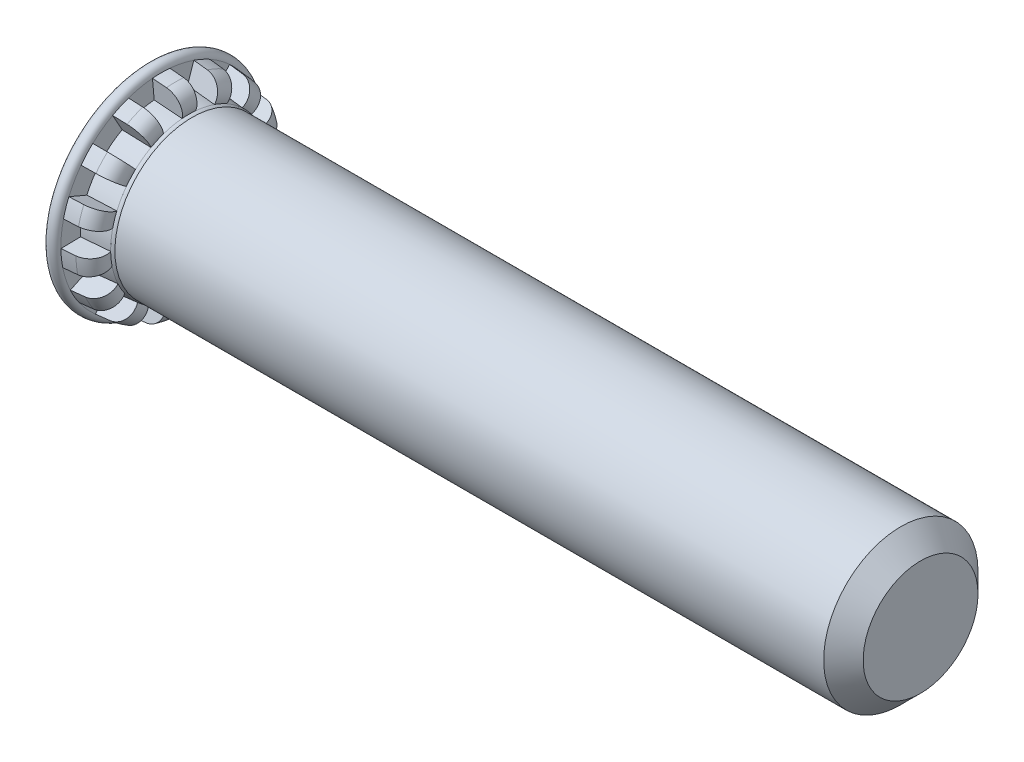
from build123d import *

# Parameters (mm, degrees)
BOSS_EXTRUDE1_START = 12.5
SKETCH2_R           = 2.5
BOSS_EXTRUDE1_DEPTH = 25
REVOLVE2_ANGLE      = 10
CIRPATTERN1_COUNT   = 15
CHAMFER1_SIZE       = 0.64


with BuildPart() as part:
    # Sketch2 → Boss-Extrude1 (new body)
    with BuildSketch(Plane(origin=(0, 0, 0), x_dir=(0, 0, -1), z_dir=(1, 0, 0)).offset(BOSS_EXTRUDE1_START)):
        Circle(SKETCH2_R)
    extrude(amount=-BOSS_EXTRUDE1_DEPTH)

    # Sketch5 → Revolve1 (revolve)
    with BuildSketch(Plane.XY, mode=Mode.PRIVATE) as revolve1_sk:
        with BuildLine():
            Line((-12.5, 0), (-12.5, 3.25))
            ThreePointArc((-12.5, 3.25), (-12.3, 3.45), (-12.1, 3.25))
            Line((-12.1, 3.25), (-12.1, 2.61341341))
            Line((-12.1, 2.61341341), (-11.202890026, 2.534926458))
            ThreePointArc((-11.202890026, 2.534926458), (-11.1, 2.5), (-11.024862675, 2.421510527))
            Line((-11.024862675, 2.421510527), (-9.626802921, 0))
            Line((-9.626802921, 0), (-12.5, 0))
        make_face()
    revolve(revolve1_sk.sketch.rotate(Axis((-12.5, 0, 0), (1, 0, 0)), 180), axis=Axis((-12.5, 0, 0), (1, 0, 0)))

    # Sketch6 → Revolve2 (revolve, symmetric)
    with BuildSketch(Plane.XY) as revolve2_sk:
        with BuildLine():
            Line((-12.1, 3.25), (-12.1, 0))
            Line((-12.1, 0), (-11.202890026, 0))
            Line((-11.202890026, 0), (-11.202890026, 2.534926458))
            ThreePointArc((-11.202890026, 2.534926458), (-11.264440532, 2.980844975), (-11.651445013, 3.210756524))
            Line((-11.651445013, 3.210756524), (-12.1, 3.25))
        make_face()
    revolve(axis=Axis((-12.1, 0, 0), (1, 0, 0)), revolution_arc=REVOLVE2_ANGLE / 2)
    revolve(revolve2_sk.sketch, axis=Axis((-12.1, 0, 0), (-1, 0, 0)), revolution_arc=REVOLVE2_ANGLE / 2)

    # CirPattern1: part ×15 about axis
    cirpattern1_axis = Axis((0, 0, 0), (1, 0, 0))


with BuildPart() as part_1:
    add(part.part)
    for i in range(1, CIRPATTERN1_COUNT):
        add(part.part.rotate(cirpattern1_axis, i * 360 / CIRPATTERN1_COUNT))

    # Chamfer1
    chamfer1_edges = [part_1.edges().sort_by_distance(p)[0] for p in [
        (12.5, 0, 2.5),
    ]]
    chamfer(chamfer1_edges, length=CHAMFER1_SIZE)


solid = part_1.part
